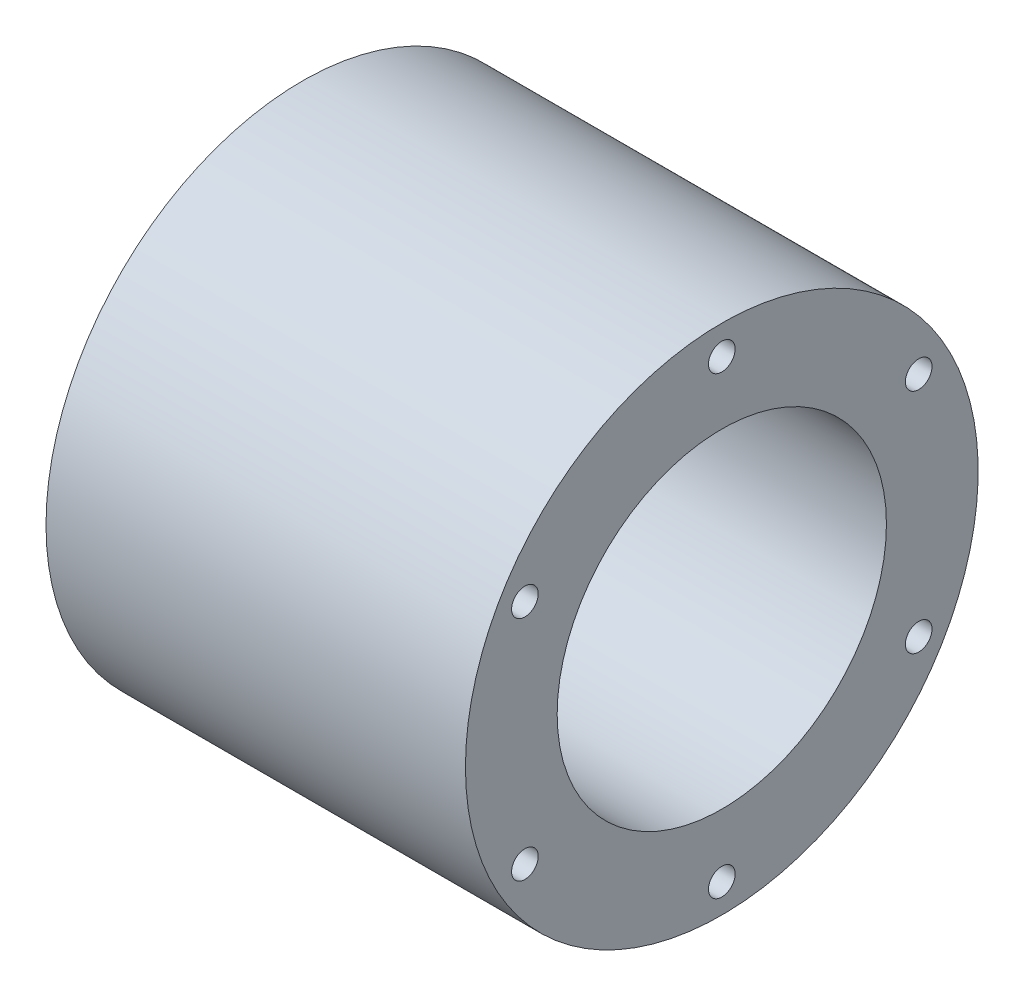
from build123d import *

# Parameters (mm, degrees)
CROQUIS1_R                       = 32.7
CROQUIS1_R_2                     = 21
SALIENTE_EXTRUIR1_DEPTH          = 24.25
CROQUIS3_R                       = 32.7
SALIENTE_EXTRUIR3_DEPTH          = 5
CROQUIS4_R                       = 3.5
CORTAR_EXTRUIR1_DEPTH            = 6
TALADRO_DE_MARGEN_PARA_M31_D     = 3.4
TALADRO_DE_MARGEN_PARA_M31_DEPTH = 10
TALADRO_DE_MARGEN_PARA_M31_TIP   = 1.021463052


with BuildPart() as part:
    # Croquis1 → Saliente-Extruir1 (new, symmetric)
    with BuildSketch(Plane(origin=(0, 0, 0), x_dir=(0, 0, -1), z_dir=(1, 0, 0))):
        with Locations(Location((0, 0, 0), (0, 0, 180))):
            Circle(CROQUIS1_R)
        with Locations(Location((0, 0, 0), (0, 0, 180))):
            Circle(CROQUIS1_R_2, mode=Mode.SUBTRACT)
    extrude(amount=SALIENTE_EXTRUIR1_DEPTH, both=True)

    # Croquis3 → Saliente-Extruir3 (add)
    with BuildSketch(Plane.ZY.offset(24.25)):
        Circle(CROQUIS3_R)
        with BuildLine():
            Line((-18, -21), (18, -21))
            ThreePointArc((18, -21), (20.121320344, -20.121320344), (21, -18))
            Line((21, -18), (21, 18))
            ThreePointArc((21, 18), (20.121320344, 20.121320344), (18, 21))
            Line((18, 21), (-18, 21))
            ThreePointArc((-18, 21), (-20.121320344, 20.121320344), (-21, 18))
            Line((-21, 18), (-21, -18))
            ThreePointArc((-21, -18), (-20.121320344, -20.121320344), (-18, -21))
        make_face(mode=Mode.SUBTRACT)
    extrude(amount=SALIENTE_EXTRUIR3_DEPTH)

    # Croquis4 → Cortar-Extruir1 (cut)
    with BuildSketch(Plane.ZY.offset(24.25)):
        with Locations((15.5, 15.5)):
            Circle(CROQUIS4_R)
        with Locations((-15.5, 15.5)):
            Circle(CROQUIS4_R)
        with Locations((-15.5, -15.5)):
            Circle(CROQUIS4_R)
        with Locations((15.5, -15.5)):
            Circle(CROQUIS4_R)
    extrude(amount=-CORTAR_EXTRUIR1_DEPTH, mode=Mode.SUBTRACT)

    # Taladro de margen para M31
    with Locations(Plane(origin=(24.25, 0, 0), x_dir=(0, 0, -1), z_dir=(1, 0, 0))):
        with Locations((0, 29), (25.11473671, 14.5), (25.11473671, -14.5), (0, -29), (-25.11473671, -14.5), (-25.11473671, 14.5)):
            Hole(TALADRO_DE_MARGEN_PARA_M31_D / 2, depth=TALADRO_DE_MARGEN_PARA_M31_DEPTH)
            with Locations((0, 0, -(TALADRO_DE_MARGEN_PARA_M31_DEPTH + TALADRO_DE_MARGEN_PARA_M31_TIP / 2))):  # 118° drill point
                Cone(0, TALADRO_DE_MARGEN_PARA_M31_D / 2, TALADRO_DE_MARGEN_PARA_M31_TIP, mode=Mode.SUBTRACT)


solid = part.part
